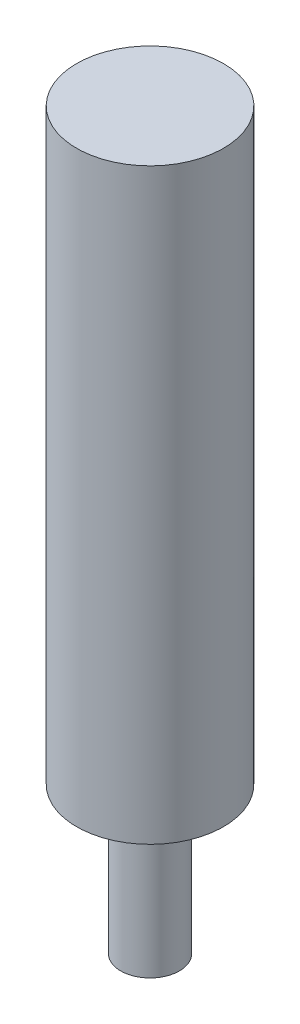
from build123d import *


with BuildPart() as part:
    # Sketch1 → Cuerpo (revolve)
    with BuildSketch(Plane.XY, mode=Mode.PRIVATE) as cuerpo_sk:
        Polygon((0, 0), (5, 0), (5, -40), (2, -40), (2, -50), (0, -50), align=None)
    revolve(cuerpo_sk.sketch.rotate(Axis((0, -54, 0), (0, 1, 0)), 90), axis=Axis((0, -54, 0), (0, 1, 0)))


solid = part.part
